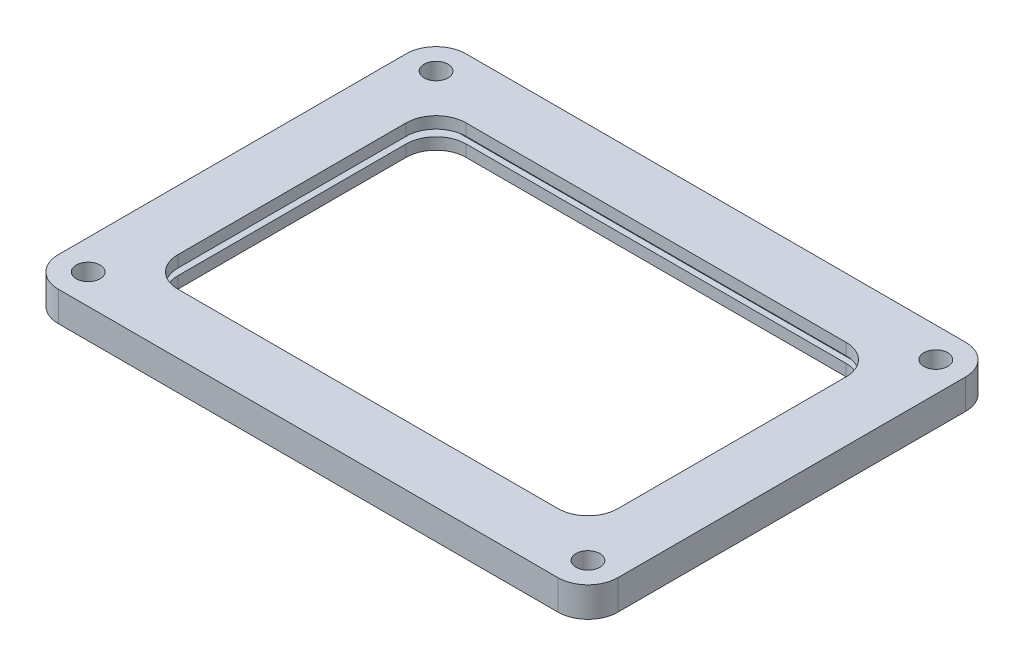
from build123d import *

# Parameters (mm, degrees)
SKETCH1_W           = 93.58
SKETCH1_H           = 68.18
BOSS_EXTRUDE1_DEPTH = 5
SKETCH1_12_W        = 73.58
SKETCH1_12_H        = 48.18
CUT_EXTRUDE2_DEPTH  = 59.107075301
FILLET1_R           = 5
FILLET2_R           = 5
SKETCH1_13_R        = 2
CUT_EXTRUDE3_DEPTH  = 59.107075301
SKETCH2_W           = 50.18
SKETCH2_H           = 1.1
CUT_EXTRUDE4_DEPTH  = 88.58


with BuildPart() as part:
    # Sketch1 → Boss-Extrude1 (new body)
    with BuildSketch(Plane(origin=(0, 0, 0), x_dir=(1, 0, 0), z_dir=(0, 1, 0))):
        Rectangle(SKETCH1_W, SKETCH1_H)
    extrude(amount=BOSS_EXTRUDE1_DEPTH)

    # Sketch1<12> → Cut-Extrude2 (cut, through all)
    with BuildSketch(Plane(origin=(0, 0, 0), x_dir=(1, 0, 0), z_dir=(0, 1, 0))):
        Rectangle(SKETCH1_12_W, SKETCH1_12_H)
    extrude(amount=CUT_EXTRUDE2_DEPTH, mode=Mode.SUBTRACT)

    # Fillet1
    fillet1_edges = [part.edges().sort_by_distance(p)[0] for p in [
        (-46.79, 2.5, 34.09),
        (-46.79, 2.5, -34.09),
        (46.79, 2.5, -34.09),
        (46.79, 2.5, 34.09),
    ]]
    fillet(fillet1_edges, radius=FILLET1_R)

    # Fillet2
    fillet2_edges = [part.edges().sort_by_distance(p)[0] for p in [
        (-36.79, 2.5, -24.09),
        (-36.79, 2.5, 24.09),
        (36.79, 2.5, 24.09),
        (36.79, 2.5, -24.09),
    ]]
    fillet(fillet2_edges, radius=FILLET2_R)

    # Sketch1<13> → Cut-Extrude3 (cut, through all)
    with BuildSketch(Plane(origin=(0, 0, 0), x_dir=(1, 0, 0), z_dir=(0, 1, 0))):
        with Locations(Location((-41.79, 29.09, 0), (0, 0, 270))):
            Circle(SKETCH1_13_R)
        with Locations(Location((41.79, 29.09, 0), (0, 0, 90))):
            Circle(SKETCH1_13_R)
        with Locations(Location((41.79, -29.09, 0), (0, 0, 270))):
            Circle(SKETCH1_13_R)
        with Locations(Location((-41.79, -29.09, 0), (0, 0, 90))):
            Circle(SKETCH1_13_R)
    extrude(amount=CUT_EXTRUDE3_DEPTH, mode=Mode.SUBTRACT)

    # Sketch2 → Cut-Extrude4 (cut)
    with BuildSketch(Plane.ZY.offset(46.79)):
        with Locations((0, 2.5)):
            Rectangle(SKETCH2_W, SKETCH2_H)
    extrude(amount=-CUT_EXTRUDE4_DEPTH, mode=Mode.SUBTRACT)


solid = part.part
